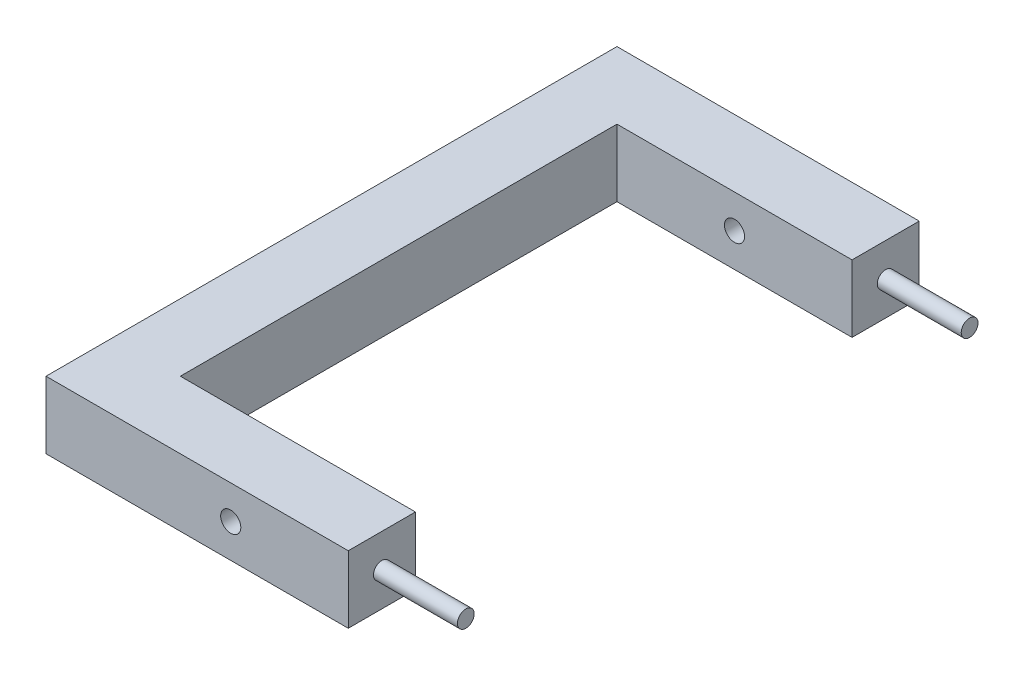
from build123d import *

# Parameters (mm, degrees)
BOSS_EXTRUDE1_DEPTH = 40
SKETCH2_R           = 6
CUT_EXTRUDE1_DEPTH  = 395
SKETCH3_R           = 5
BOSS_EXTRUDE2_DEPTH = 50


with BuildPart() as part:
    # Sketch1 → Boss-Extrude1 (new body)
    with BuildSketch(Plane(origin=(0, 0, 0), x_dir=(1, 0, 0), z_dir=(0, 1, 0))):
        Polygon((0, 170), (180, 170), (180, 130), (40, 130), (40, -130), (180, -130), (180, -170), (0, -170), align=None)
    extrude(amount=BOSS_EXTRUDE1_DEPTH)

    # Sketch2 → Cut-Extrude1 (cut)
    with BuildSketch(Plane.XY.offset(170)):
        with Locations((110, 20)):
            Circle(SKETCH2_R)
    extrude(amount=-CUT_EXTRUDE1_DEPTH, mode=Mode.SUBTRACT)

    # Sketch3 → Boss-Extrude2 (add)
    with BuildSketch(Plane(origin=(180, 0, 0), x_dir=(0, 0, -1), z_dir=(1, 0, 0))):
        with Locations(Location((-150, 20, 0), (0, 0, 180))):
            Circle(SKETCH3_R)
        with Locations(Location((150, 20, 0), (0, 0, 180))):
            Circle(SKETCH3_R)
    extrude(amount=BOSS_EXTRUDE2_DEPTH)


solid = part.part
